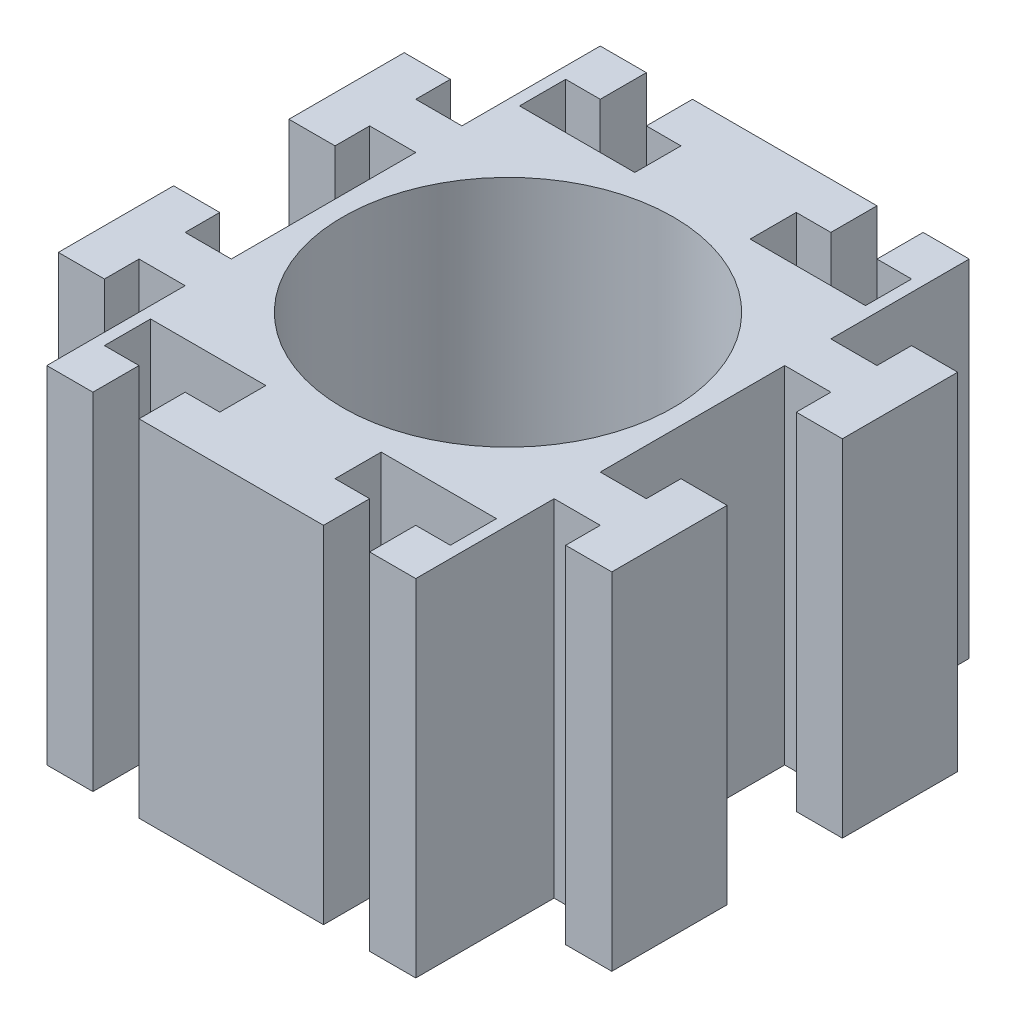
from build123d import *

# Parameters (mm, degrees)
SKETCH1_W               = 30.48
SKETCH1_H               = 30.48
BOSS_EXTRUDE1_DEPTH     = 19.05
SKETCH4_R               = 9.1
CUT_EXTRUDE1_DEPTH      = 15.24
CUT_EXTRUDE2_REACH      = 30.765
SKETCH5_R               = 2.669997608
CUT_EXTRUDE3_DEPTH      = 29.764869198
CUT_EXTRUDE3_DEPTH_BACK = 19.05
SKETCH6_OUTSIDE_W       = 41.906
SKETCH6_OUTSIDE_H       = 41.906


with BuildPart() as part:
    # Sketch1 → Boss-Extrude1 (new body)
    with BuildSketch(Plane(origin=(0, 0, 0), x_dir=(1, 0, 0), z_dir=(0, 1, 0))):
        Rectangle(SKETCH1_W, SKETCH1_H)
    extrude(amount=BOSS_EXTRUDE1_DEPTH)

    # Sketch4 → Cut-Extrude1 (cut)
    with BuildSketch(Plane(origin=(0, 19.05, 0), x_dir=(1, 0, 0), z_dir=(0, 1, 0))):
        with Locations(Location((0, 0, 0), (0, 0, 270))):
            Circle(SKETCH4_R)
    extrude(amount=-CUT_EXTRUDE1_DEPTH, mode=Mode.SUBTRACT)

    # Sketch5 → Cut-Extrude2 (cut, up to next)
    with BuildSketch(Plane.XZ, mode=Mode.PRIVATE) as cut_extrude2_sk1:
        with Locations(Location((0, 0, 0), (0, 0, 270))):
            Circle(SKETCH5_R)
    cut_extrude2_tool1 = extrude(cut_extrude2_sk1.sketch, amount=-CUT_EXTRUDE2_REACH, mode=Mode.PRIVATE) & part.part
    add(cut_extrude2_tool1.solids().sort_by_distance((0, 0, 0))[0], mode=Mode.SUBTRACT)

    # Sketch6 outside → Cut-Extrude3 (cut, two sides: drawn at the far end of the back side and taken through both)
    with BuildSketch(Plane(origin=(0, 19.05, 0), x_dir=(1, 0, 0), z_dir=(0, 1, 0)).offset(-CUT_EXTRUDE3_DEPTH_BACK)):
        Rectangle(SKETCH6_OUTSIDE_W, SKETCH6_OUTSIDE_H)
        Polygon((-7.62, 15.24), (-7.62, 12.7), (-9.525, 12.7), (-9.525, 10.16), (-3.175, 10.16), (-3.175, 12.7), (-5.08, 12.7), (-5.08, 15.24), (5.08, 15.24), (5.08, 12.7), (3.175, 12.7), (3.175, 10.16), (9.525, 10.16), (9.525, 12.7), (7.62, 12.7), (7.62, 15.24), (10.16, 15.24), (10.16, 7.62), (12.7, 7.62), (12.7, 9.525), (15.24, 9.525), (15.24, 3.175), (12.7, 3.175), (12.7, 5.08), (10.16, 5.08), (10.16, -5.08), (12.7, -5.08), (12.7, -3.175), (15.24, -3.175), (15.24, -9.525), (12.7, -9.525), (12.7, -7.62), (10.16, -7.62), (10.16, -15.24), (7.62, -15.24), (7.62, -12.7), (9.525, -12.7), (9.525, -10.16), (3.175, -10.16), (3.175, -12.7), (5.08, -12.7), (5.08, -15.24), (-5.08, -15.24), (-5.08, -12.7), (-3.175, -12.7), (-3.175, -10.16), (-9.525, -10.16), (-9.525, -12.7), (-7.62, -12.7), (-7.62, -15.24), (-10.16, -15.24), (-10.16, -7.62), (-12.7, -7.62), (-12.7, -9.525), (-15.24, -9.525), (-15.24, -3.175), (-12.7, -3.175), (-12.7, -5.08), (-10.16, -5.08), (-10.16, 5.08), (-12.7, 5.08), (-12.7, 3.175), (-15.24, 3.175), (-15.24, 9.525), (-12.7, 9.525), (-12.7, 7.62), (-10.16, 7.62), (-10.16, 15.24), align=None, mode=Mode.SUBTRACT)
    extrude(amount=CUT_EXTRUDE3_DEPTH + CUT_EXTRUDE3_DEPTH_BACK, mode=Mode.SUBTRACT)


solid = part.part
